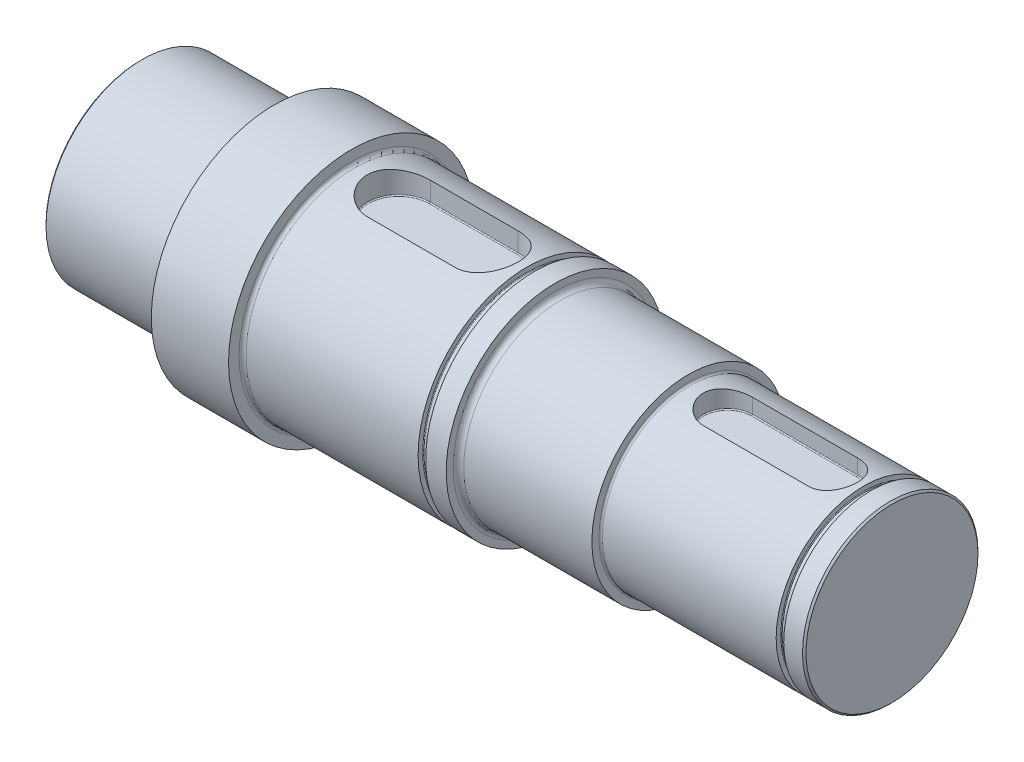
from build123d import *

# Parameters (mm, degrees)
SKETCH1_R               = 35
BOSS_EXTRUDE1_DEPTH     = 100
CUT_EXTRUDE1_START      = -32
SKETCH2_R               = 35
SKETCH2_R_2             = 27.5
CUT_EXTRUDE1_DEPTH      = 32
SKETCH3_R               = 35
SKETCH3_R_2             = 25
CUT_EXTRUDE2_DEPTH      = 58
SKETCH4_R               = 35
SKETCH4_R_2             = 27.5
CUT_EXTRUDE3_DEPTH      = 30
SKETCH5_R               = 35
SKETCH5_R_2             = 31
CUT_EXTRUDE4_DEPTH      = 58
FILLET1_R               = 1.5
FILLET4_R               = 1
SKETCH9_W               = 2.15
SKETCH9_H               = 3.572537074
FILLET8_R               = 0.2
CUT_EXTRUDE5_REACH      = 137.58
CUT_EXTRUDE5_END_RADIUS = 31
CUT_EXTRUDE5_START      = 24
SKETCH12_R              = 27.5
BOSS_EXTRUDE2_DEPTH     = 6
CHAMFER1_SIZE           = 0.5
BOSS_EXTRUDE3_START     = 8
SKETCH13_R              = 25
BOSS_EXTRUDE3_DEPTH     = 8
BOSS_EXTRUDE4_START     = 8
SKETCH15_R              = 27.5
BOSS_EXTRUDE4_DEPTH     = 8
SKETCH17_W              = 2.15
SKETCH17_H              = 3.433633372
FILLET9_R               = 0.2
CHAMFER2_SIZE           = 0.5
CUT_EXTRUDE6_REACH      = 140.302
CUT_EXTRUDE6_END_RADIUS = 25
CUT_EXTRUDE6_START      = 19.5
FILLET10_R              = 0.3
FILLET11_R              = 0.5


with BuildPart() as part:
    # Sketch1 → Boss-Extrude1 (new, symmetric)
    with BuildSketch(Plane(origin=(0, 0, 0), x_dir=(0, 0, -1), z_dir=(1, 0, 0))):
        Circle(SKETCH1_R)
    extrude(amount=BOSS_EXTRUDE1_DEPTH, both=True)

    # Sketch2 → Cut-Extrude1 (cut)
    with BuildSketch(Plane.ZY.offset(100).offset(CUT_EXTRUDE1_START)):
        Circle(SKETCH2_R)
        Circle(SKETCH2_R_2, mode=Mode.SUBTRACT)
    extrude(amount=CUT_EXTRUDE1_DEPTH, mode=Mode.SUBTRACT)

    # Sketch3 → Cut-Extrude2 (cut)
    with BuildSketch(Plane(origin=(100, 0, 0), x_dir=(0, 0, -1), z_dir=(1, 0, 0))):
        with Locations(Location((0, 0, 0), (0, 0, 180))):
            Circle(SKETCH3_R)
        Circle(SKETCH3_R_2, mode=Mode.SUBTRACT)
    extrude(amount=-CUT_EXTRUDE2_DEPTH, mode=Mode.SUBTRACT)

    # Sketch4 → Cut-Extrude3 (cut)
    with BuildSketch(Plane(origin=(42, 0, 0), x_dir=(0, 0, -1), z_dir=(1, 0, 0))):
        with Locations(Location((0, 0, 0), (0, 0, 180))):
            Circle(SKETCH4_R)
        with Locations(Location((0, 0, 0), (0, 0, 180))):
            Circle(SKETCH4_R_2, mode=Mode.SUBTRACT)
    extrude(amount=-CUT_EXTRUDE3_DEPTH, mode=Mode.SUBTRACT)

    # Sketch5 → Cut-Extrude4 (cut)
    with BuildSketch(Plane(origin=(12, 0, 0), x_dir=(0, 0, -1), z_dir=(1, 0, 0))):
        with Locations(Location((0, 0, 0), (0, 0, 180))):
            Circle(SKETCH5_R)
        Circle(SKETCH5_R_2, mode=Mode.SUBTRACT)
    extrude(amount=-CUT_EXTRUDE4_DEPTH, mode=Mode.SUBTRACT)

    # Fillet1
    fillet1_edges = [part.edges().sort_by_distance(p)[0] for p in [
        (12, 0, -27.5),
        (-68, 0, -27.5),
    ]]
    fillet(fillet1_edges, radius=FILLET1_R)

    # Fillet4
    fillet4_edges = [part.edges().sort_by_distance(p)[0] for p in [
        (-46, 0, 31),
    ]]
    fillet(fillet4_edges, radius=FILLET4_R)

    # Sketch9 → Cut-Revolve4 (revolve, cut)
    with BuildSketch(Plane.XY, mode=Mode.PRIVATE) as cut_revolve4_sk:
        with Locations((5.075, 31.286268537)):
            Rectangle(SKETCH9_W, SKETCH9_H)
    revolve(cut_revolve4_sk.sketch.rotate(Axis((0, 0, 0), (-1, 0, 0)), 90), axis=Axis((0, 0, 0), (-1, 0, 0)), mode=Mode.SUBTRACT)

    # Fillet8
    fillet8_edges = [part.edges().sort_by_distance(p)[0] for p in [
        (4, 0, 29.5),
        (6.15, 0, 29.5),
    ]]
    fillet(fillet8_edges, radius=FILLET8_R)

    # Cut-Extrude5: up to this cylinder (the profile starts inside it)
    cut_extrude5_end = Plane(origin=(-20, 0, 0), z_dir=(1, 0, 0)) * Cylinder(CUT_EXTRUDE5_END_RADIUS, 338.16, mode=Mode.PRIVATE)
    # Sketch10 → Cut-Extrude5 (cut, up to the surface)
    with BuildSketch(Plane(origin=(0, 0, 0), x_dir=(1, 0, 0), z_dir=(0, 1, 0)).offset(CUT_EXTRUDE5_START), mode=Mode.PRIVATE) as cut_extrude5_sk1:
        with BuildLine():
            Line((-7.5, -9), (-32.5, -9))
            ThreePointArc((-32.5, -9), (-41.5, 0), (-32.5, 9))
            Line((-32.5, 9), (-7.5, 9))
            ThreePointArc((-7.5, 9), (1.5, 0), (-7.5, -9))
        make_face()
    cut_extrude5_tool1 = extrude(cut_extrude5_sk1.sketch, amount=CUT_EXTRUDE5_REACH, mode=Mode.PRIVATE) & cut_extrude5_end
    add(cut_extrude5_tool1.solids().sort_by_distance((-20, 24, 0))[0], mode=Mode.SUBTRACT)

    # Sketch12 → Boss-Extrude2 (add)
    with BuildSketch(Plane.ZY.offset(100)):
        Circle(SKETCH12_R)
    extrude(amount=BOSS_EXTRUDE2_DEPTH)

    # Chamfer1
    chamfer1_edges = [part.edges().sort_by_distance(p)[0] for p in [
        (-106, 0, -27.5),
    ]]
    chamfer(chamfer1_edges, length=CHAMFER1_SIZE)

    # Sketch13 → Boss-Extrude3 (add)
    with BuildSketch(Plane(origin=(100, 0, 0), x_dir=(0, 0, -1), z_dir=(1, 0, 0)).offset(BOSS_EXTRUDE3_START)):
        Circle(SKETCH13_R)
    extrude(amount=-BOSS_EXTRUDE3_DEPTH)

    # Sketch15 → Boss-Extrude4 (add)
    with BuildSketch(Plane(origin=(42, 0, 0), x_dir=(0, 0, -1), z_dir=(1, 0, 0)).offset(BOSS_EXTRUDE4_START)):
        with Locations(Location((0, 0, 0), (0, 0, 180))):
            Circle(SKETCH15_R)
    extrude(amount=-BOSS_EXTRUDE4_DEPTH)

    # Sketch17 → Cut-Revolve5 (revolve, cut)
    with BuildSketch(Plane.XY, mode=Mode.PRIVATE) as cut_revolve5_sk:
        with Locations((101.075, 25.216816686)):
            Rectangle(SKETCH17_W, SKETCH17_H)
    revolve(cut_revolve5_sk.sketch.rotate(Axis((80.697910844, 0, 0), (1, 0, 0)), 270), axis=Axis((80.697910844, 0, 0), (1, 0, 0)), mode=Mode.SUBTRACT)

    # Fillet9
    fillet9_edges = [part.edges().sort_by_distance(p)[0] for p in [
        (100, 0, 23.5),
        (102.15, 0, 23.5),
    ]]
    fillet(fillet9_edges, radius=FILLET9_R)

    # Chamfer2
    chamfer2_edges = [part.edges().sort_by_distance(p)[0] for p in [
        (108, 0, 25),
    ]]
    chamfer(chamfer2_edges, length=CHAMFER2_SIZE)

    # Cut-Extrude6: up to this cylinder (the profile starts inside it)
    cut_extrude6_end = Plane(origin=(76.2, 0, 0), z_dir=(1, 0, 0)) * Cylinder(CUT_EXTRUDE6_END_RADIUS, 331.604, mode=Mode.PRIVATE)
    # Sketch18 → Cut-Extrude6 (cut, up to the surface)
    with BuildSketch(Plane(origin=(0, 0, 0), x_dir=(1, 0, 0), z_dir=(0, 1, 0)).offset(CUT_EXTRUDE6_START), mode=Mode.PRIVATE) as cut_extrude6_sk1:
        with BuildLine():
            Line((61.2, -7), (91.2, -7))
            ThreePointArc((91.2, -7), (98.2, 0), (91.2, 7))
            Line((91.2, 7), (61.2, 7))
            ThreePointArc((61.2, 7), (54.2, 0), (61.2, -7))
        make_face()
    cut_extrude6_tool1 = extrude(cut_extrude6_sk1.sketch, amount=CUT_EXTRUDE6_REACH, mode=Mode.PRIVATE) & cut_extrude6_end
    add(cut_extrude6_tool1.solids().sort_by_distance((76.2, 19.5, 0))[0], mode=Mode.SUBTRACT)

    # Fillet10
    fillet10_edges = [part.edges().sort_by_distance(p)[0] for p in [
        (98.2, 19.5, 0),
        (76.2, 19.5, -7),
        (54.2, 19.5, 0),
        (76.2, 19.5, 7),
        (-41.5, 24, 0),
        (-20, 24, 9),
        (1.5, 24, 0),
        (-20, 24, -9),
    ]]
    fillet(fillet10_edges, radius=FILLET10_R)

    # Fillet11
    fillet11_edges = [part.edges().sort_by_distance(p)[0] for p in [
        (50, 0, 25),
    ]]
    fillet(fillet11_edges, radius=FILLET11_R)


solid = part.part
